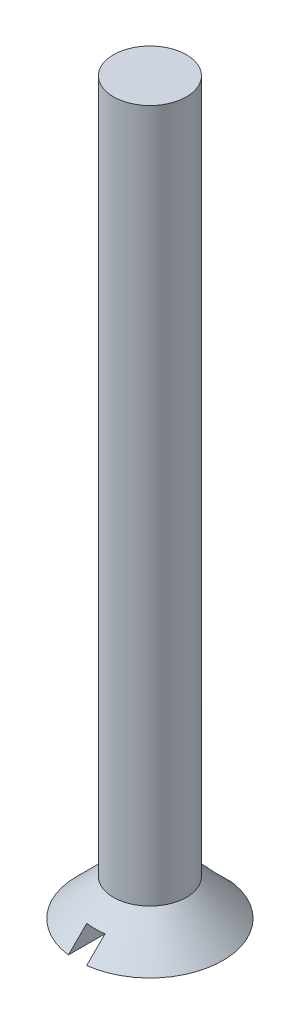
from build123d import *

# Parameters (mm, degrees)
SKETCH2_W          = 0.5
SKETCH2_H          = 4
CUT_EXTRUDE1_DEPTH = 0.5


with BuildPart() as part:
    # Sketch1 → Revolve1 (revolve)
    with BuildSketch(Plane.XY):
        Polygon((0, 20), (0, 0), (-2, 0), (-1, 1), (-1, 20), align=None)
    revolve(axis=Axis((0, 20, 0), (0, -1, 0)))

    # Sketch2 → Cut-Extrude1 (cut)
    with BuildSketch(Plane.XZ):
        Rectangle(SKETCH2_W, SKETCH2_H)
    extrude(amount=-CUT_EXTRUDE1_DEPTH, mode=Mode.SUBTRACT)


solid = part.part
